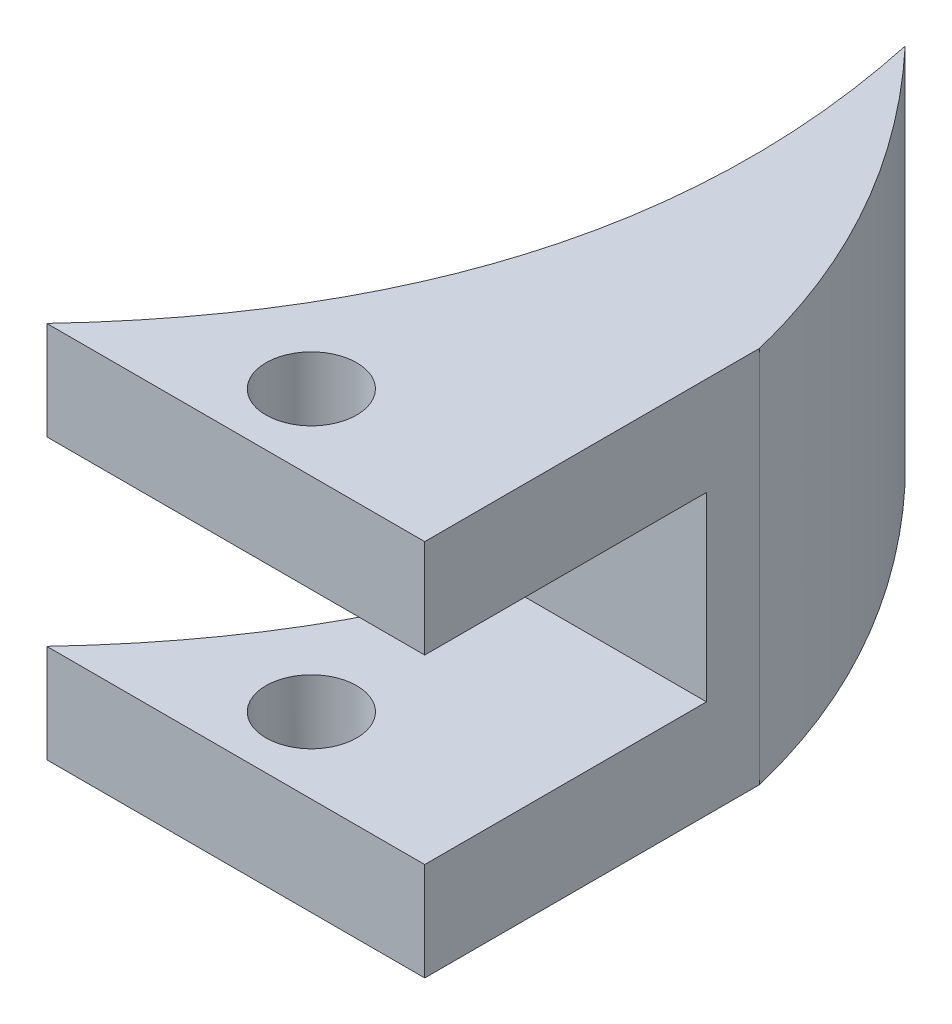
from build123d import *

# Parameters (mm, degrees)
SKETCH_1_W          = 25
SKETCH_1_H          = 25
EXTRUDE_1_DEPTH     = 44.284173786
SKETCH_2_R          = 3
CUT_EXTRUDE_1_DEPTH = 36.406845426
SKETCH_4_W          = 25
SKETCH_4_H          = 12
CUT_EXTRUDE_2_DEPTH = 18.639834826
CUT_EXTRUDE_3_DEPTH = 40


with BuildPart() as part:
    # 스케치1 → 보스-돌출1 (new body)
    with BuildSketch(Plane.XY):
        Rectangle(SKETCH_1_W, SKETCH_1_H)
    extrude(amount=EXTRUDE_1_DEPTH)

    # 스케치2 → 컷-돌출1 (cut)
    with BuildSketch(Plane(origin=(0, 12.5, 0), x_dir=(1, 0, 0), z_dir=(0, 1, 0))):
        with Locations(Location((0, -39.284173786, 0), (0, 0, 270))):
            Circle(SKETCH_2_R)
    extrude(amount=-CUT_EXTRUDE_1_DEPTH, mode=Mode.SUBTRACT)

    # 스케치4 → 컷-돌출2 (cut)
    with BuildSketch(Plane.XY.offset(44.284173786)):
        Rectangle(SKETCH_4_W, SKETCH_4_H)
    extrude(amount=-CUT_EXTRUDE_2_DEPTH, mode=Mode.SUBTRACT)

    # 스케치5 → 컷-돌출3 (cut)
    with BuildSketch(Plane(origin=(0, 12.5, 0), x_dir=(1, 0, 0), z_dir=(0, 1, 0))):
        with BuildLine():
            Line((-47.02485921, -52.228316923), (5.705393133, 41.461873578))
            Line((5.705393133, 41.461873578), (28.83172343, -24.155832398))
            Line((28.83172343, -24.155832398), (12.5, -44.284173786))
            add(Edge.make_bspline(
                [(0, 0), (17.942606177, -19.069541042), (12.5, -44.284173786)],
                knots=[0, 0, 0, 1, 1, 1], degree=2))
            add(Edge.make_bspline(
                [(0, 0), (5.442606177, -25.214632744), (-12.5, -44.284173786)],
                knots=[0, 0, 0, 1, 1, 1], degree=2))
            Line((-12.5, -44.284173786), (-47.02485921, -52.228316923))
        make_face()
    extrude(amount=-CUT_EXTRUDE_3_DEPTH, mode=Mode.SUBTRACT)


solid = part.part
